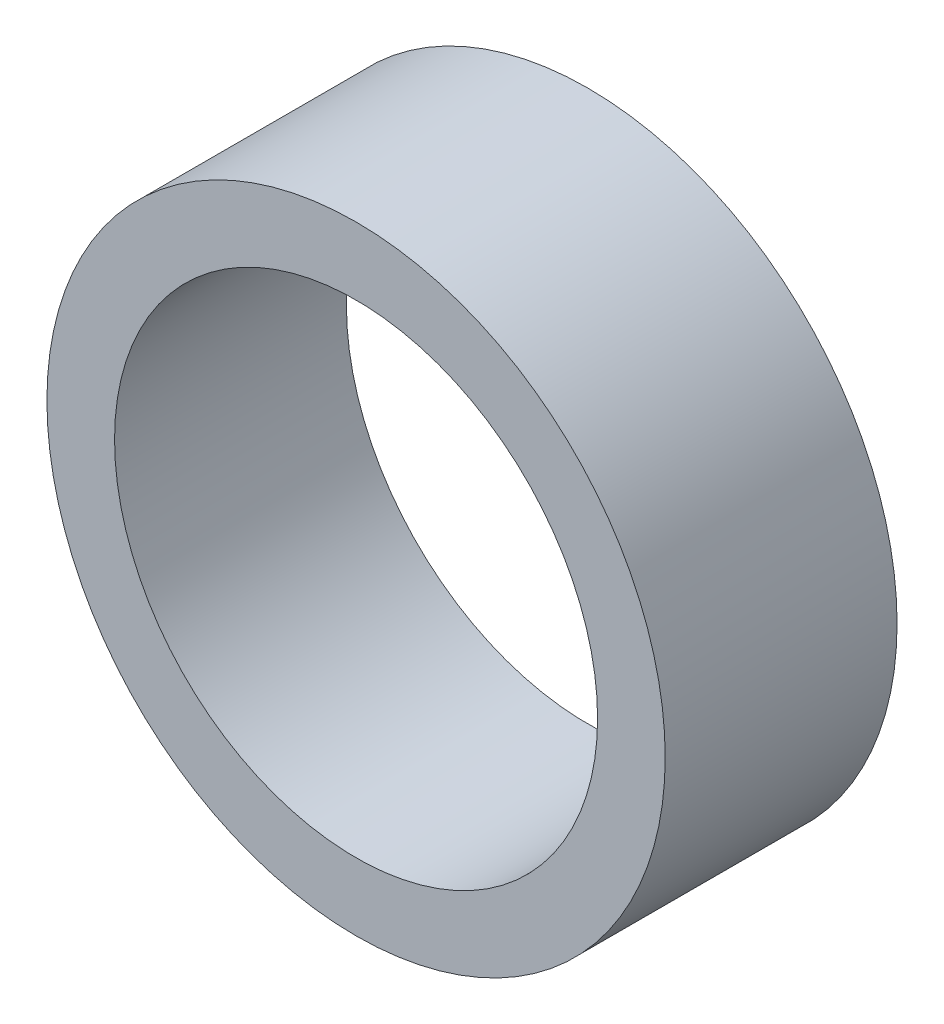
from build123d import *

# Parameters (mm, degrees)
SKETCH1_R           = 16
SKETCH1_R_2         = 12.5
BOSS_EXTRUDE1_DEPTH = 12


with BuildPart() as part:
    # Sketch1 → Boss-Extrude1 (new body)
    with BuildSketch(Plane.XY):
        Circle(SKETCH1_R)
        Circle(SKETCH1_R_2, mode=Mode.SUBTRACT)
    extrude(amount=BOSS_EXTRUDE1_DEPTH)


solid = part.part
